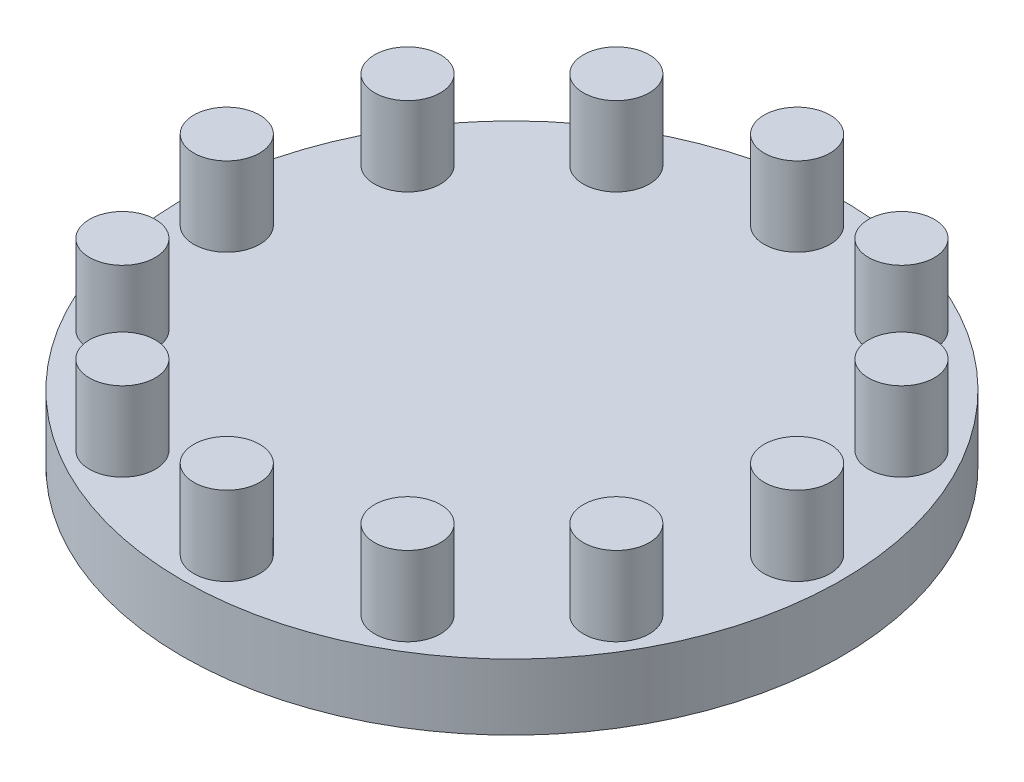
from build123d import *

# Parameters (mm, degrees)
CROQUIS3_R              = 50
SALIENTE_EXTRUIR2_DEPTH = 10
CROQUIS4_R              = 5
SALIENTE_EXTRUIR3_DEPTH = 12
MATRIZC1_COUNT          = 12


with BuildPart() as part:
    # Croquis3 → Saliente-Extruir2 (new body)
    with BuildSketch(Plane(origin=(0, 0, 0), x_dir=(1, 0, 0), z_dir=(0, 1, 0))):
        with Locations(Location((0, 0, 0), (0, 0, 270))):
            Circle(CROQUIS3_R)
    extrude(amount=SALIENTE_EXTRUIR2_DEPTH)

    # Croquis4 → Saliente-Extruir3 (add)
    with BuildSketch(Plane(origin=(0, 10, 0), x_dir=(1, 0, 0), z_dir=(0, 1, 0))):
        with Locations(Location((0, 43.264151253, 0), (0, 0, 270))):
            Circle(CROQUIS4_R)
    saliente_extruir3 = extrude(amount=SALIENTE_EXTRUIR3_DEPTH)

    # MatrizC1: Saliente-Extruir3 ×12 about axis
    matrizc1_axis = Axis((0, 0, 0), (0, 1, 0))
    for i in range(1, MATRIZC1_COUNT):
        add(saliente_extruir3.rotate(matrizc1_axis, i * 360 / MATRIZC1_COUNT))


solid = part.part
